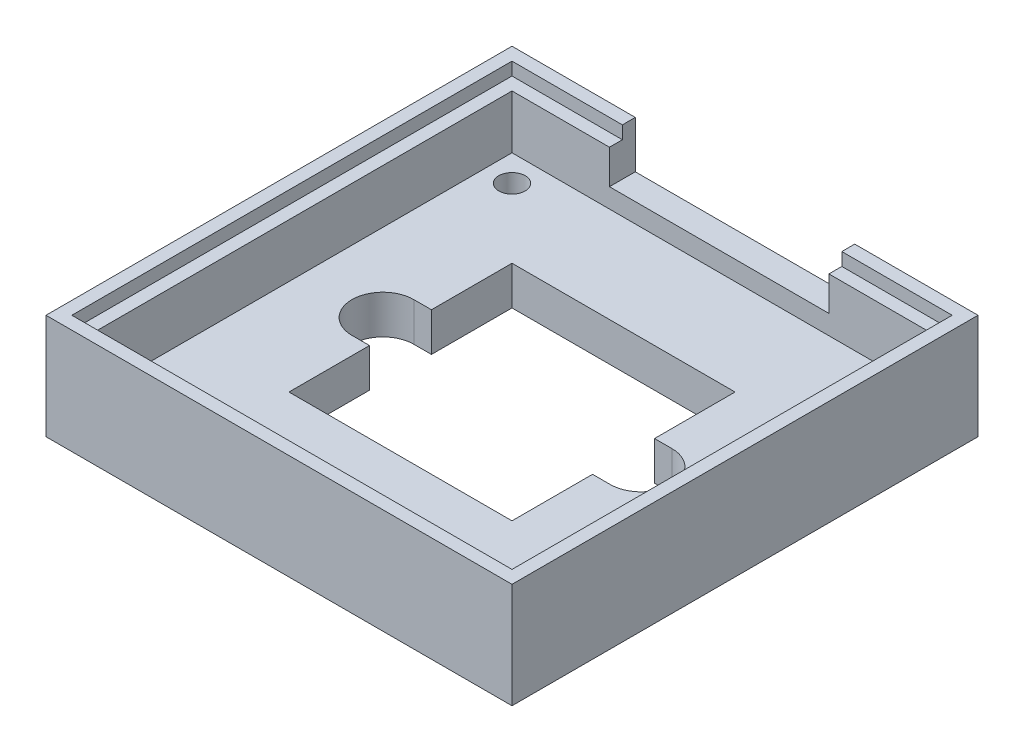
from build123d import *

# Parameters (mm, degrees)
SKETCH1_W           = 36.1
SKETCH1_H           = 36.1
SKETCH1_R           = 1.025
BOSS_EXTRUDE1_DEPTH = 3
SKETCH1_3_W         = 36.1
SKETCH1_3_H         = 36.1
SKETCH1_3_W_2       = 32.1
SKETCH1_3_H_2       = 32.1
BOSS_EXTRUDE2_DEPTH = 8.15
SKETCH2_W           = 17
SKETCH2_H           = 3.65
CUT_EXTRUDE1_DEPTH  = 6
CUT_EXTRUDE2_DEPTH  = 1


with BuildPart() as part:
    # Sketch1 → Boss-Extrude1 (new body)
    with BuildSketch(Plane(origin=(0, 0, 0), x_dir=(1, 0, 0), z_dir=(0, 1, 0))):
        Rectangle(SKETCH1_W, SKETCH1_H)
        with Locations((-14, -14)):
            Circle(SKETCH1_R, mode=Mode.SUBTRACT)
        with Locations((14, -14)):
            Circle(SKETCH1_R, mode=Mode.SUBTRACT)
        with BuildLine():
            Line((-10, 2.4), (-8.64, 2.4))
            Line((-8.64, 2.4), (-8.64, 8.64))
            Line((-8.64, 8.64), (8.64, 8.64))
            Line((8.64, 8.64), (8.64, 2.4))
            Line((8.64, 2.4), (10, 2.4))
            ThreePointArc((10, 2.4), (12.4, 0), (10, -2.4))
            Line((10, -2.4), (8.64, -2.4))
            Line((8.64, -2.4), (8.64, -8.64))
            Line((8.64, -8.64), (-8.64, -8.64))
            Line((-8.64, -8.64), (-8.64, -2.4))
            Line((-8.64, -2.4), (-10, -2.4))
            ThreePointArc((-10, -2.4), (-12.4, 0), (-10, 2.4))
        make_face(mode=Mode.SUBTRACT)
        with Locations((-14, 14)):
            Circle(SKETCH1_R, mode=Mode.SUBTRACT)
        with Locations((14, 14)):
            Circle(SKETCH1_R, mode=Mode.SUBTRACT)
    extrude(amount=BOSS_EXTRUDE1_DEPTH)

    # Sketch1<3> → Boss-Extrude2 (add)
    with BuildSketch(Plane(origin=(0, 0, 0), x_dir=(1, 0, 0), z_dir=(0, 1, 0))):
        Rectangle(SKETCH1_3_W, SKETCH1_3_H)
        Rectangle(SKETCH1_3_W_2, SKETCH1_3_H_2, mode=Mode.SUBTRACT)
    extrude(amount=BOSS_EXTRUDE2_DEPTH)

    # Sketch2 → Cut-Extrude1 (cut)
    with BuildSketch(Plane(origin=(0, 0, -18.05), x_dir=(-1, 0, 0), z_dir=(0, 0, -1))):
        with Locations((0, 6.325)):
            Rectangle(SKETCH2_W, SKETCH2_H)
    extrude(amount=-CUT_EXTRUDE1_DEPTH, mode=Mode.SUBTRACT)

    # Sketch4 → Cut-Extrude2 (cut)
    with BuildSketch(Plane(origin=(0, 8.15, 0), x_dir=(1, 0, 0), z_dir=(0, 1, 0))):
        Polygon((17.05, -17.05), (-17.05, -17.05), (-17.05, 17.05), (-8.5, 17.05), (-8.5, 16.05), (-16.05, 16.05), (-16.05, -16.05), (16.05, -16.05), (16.05, 16.05), (8.5, 16.05), (8.5, 17.05), (17.05, 17.05), align=None)
    extrude(amount=-CUT_EXTRUDE2_DEPTH, mode=Mode.SUBTRACT)


solid = part.part
